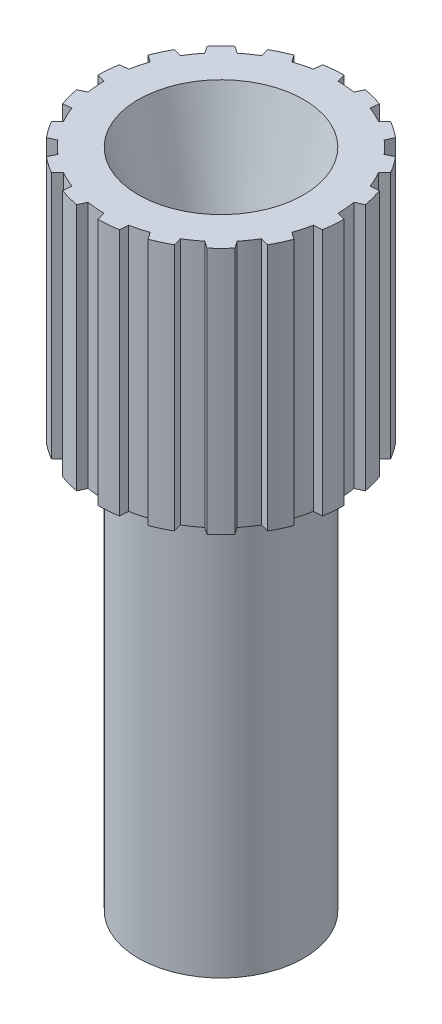
from build123d import *

# Parameters (mm, degrees)
SKETCH1_R           = 7.5
BOSS_EXTRUDE1_DEPTH = 15
SKETCH1_3_R         = 5
BOSS_EXTRUDE2_DEPTH = 25
CUT_EXTRUDE1_DEPTH  = 42.382363393
SKETCH3_R           = 5
CUT_EXTRUDE2_DEPTH  = 15
CUT_EXTRUDE2_DRAFT  = -15
CIRPATTERN1_COUNT   = 18


with BuildPart() as part:
    # Sketch1 → Boss-Extrude1 (new body)
    with BuildSketch(Plane(origin=(0, 0, 0), x_dir=(1, 0, 0), z_dir=(0, 1, 0))):
        Circle(SKETCH1_R)
    extrude(amount=BOSS_EXTRUDE1_DEPTH)

    # Sketch1<3> → Boss-Extrude2 (add)
    with BuildSketch(Plane(origin=(0, 0, 0), x_dir=(1, 0, 0), z_dir=(0, 1, 0))):
        Circle(SKETCH1_3_R)
    extrude(amount=-BOSS_EXTRUDE2_DEPTH)

    # Sketch2 → Cut-Extrude1 (cut, through all)
    with BuildSketch(Plane(origin=(0, 15, 0), x_dir=(1, 0, 0), z_dir=(0, 1, 0))):
        with BuildLine():
            Line((1.572944175, 7.843841318), (1.13617114, 6.907178522))
            ThreePointArc((1.13617114, 6.907178522), (0.610090199, 6.973362887), (0.080508816, 6.999537008))
            Line((0.080508816, 6.999537008), (-0.186978867, 7.997814633))
            ThreePointArc((-0.186978867, 7.997814633), (0.697245942, 7.969557585), (1.572944175, 7.843841318))
        make_face()
    cut_extrude1 = extrude(amount=-CUT_EXTRUDE1_DEPTH, mode=Mode.SUBTRACT)


with BuildPart() as cut_extrude2_tool:
    # Sketch3 → Cut-Extrude2 (with draft: the straight prism first)
    with BuildSketch(Plane(origin=(0, 15, 0), x_dir=(1, 0, 0), z_dir=(0, 1, 0))):
        Circle(SKETCH3_R)
    extrude(amount=-CUT_EXTRUDE2_DEPTH)
    # Cut-Extrude2: the draft: its side faces are tilted about the plane it starts from
    cut_extrude2_sides = [cut_extrude2_tool.faces().sort_by_distance(p)[0] for p in [
        (-5, 7.5, 0),
    ]]
    draft(cut_extrude2_sides, Plane(origin=(0, 15, 0), x_dir=(1, 0, 0), z_dir=(0, 1, 0)), CUT_EXTRUDE2_DRAFT)


with BuildPart() as part_1:
    add(part.part)

    # Cut-Extrude2: cut by cut_extrude2_tool
    add(cut_extrude2_tool.part, mode=Mode.SUBTRACT)

    # CirPattern1: Cut-Extrude1 ×18 about axis
    cirpattern1_axis = Axis((0, 15, 0), (0, 1, 0))
    for i in range(1, CIRPATTERN1_COUNT):
        add(cut_extrude1.rotate(cirpattern1_axis, i * 360 / CIRPATTERN1_COUNT), mode=Mode.SUBTRACT)


solid = part_1.part
